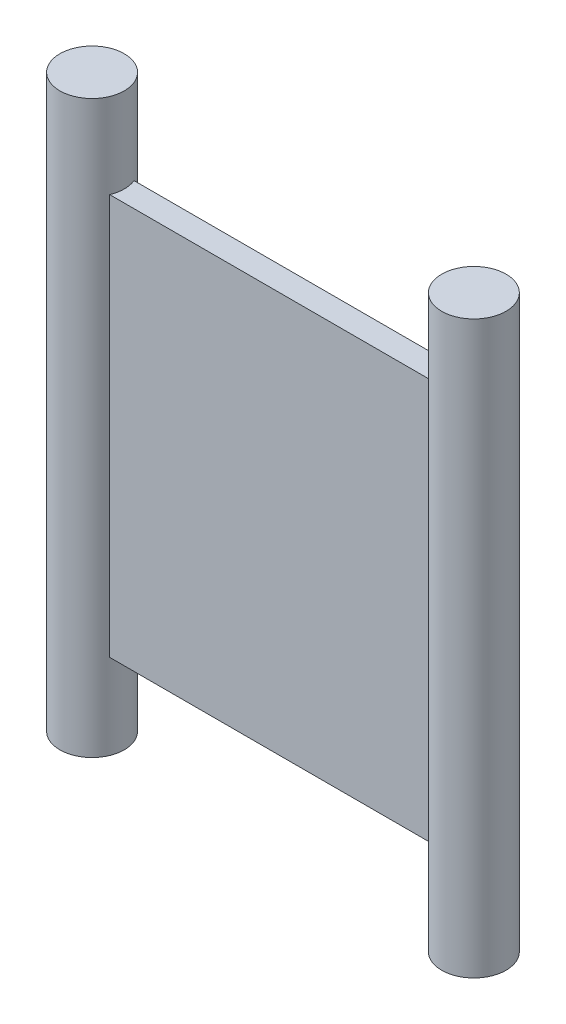
from build123d import *

# Parameters (mm, degrees)
SKETCH1_W           = 15.72
SKETCH1_H           = 1
BOSS_EXTRUDE1_DEPTH = 16.5
SKETCH2_R           = 1.325
BOSS_EXTRUDE2_DEPTH = 11.75


with BuildPart() as part:
    # Sketch1 → Boss-Extrude1 (new body)
    with BuildSketch(Plane(origin=(0, 0, 0), x_dir=(1, 0, 0), z_dir=(0, 1, 0))):
        Rectangle(SKETCH1_W, SKETCH1_H)
    extrude(amount=BOSS_EXTRUDE1_DEPTH)

    # Sketch2 → Boss-Extrude2 (add, symmetric)
    with BuildSketch(Plane(origin=(0, 8.25, 0), x_dir=(1, 0, 0), z_dir=(0, 1, 0))):
        with Locations(Location((-7.86, 0, 0), (0, 0, 270))):
            Circle(SKETCH2_R)
        with Locations(Location((7.86, 0, 0), (0, 0, 270))):
            Circle(SKETCH2_R)
    extrude(amount=BOSS_EXTRUDE2_DEPTH, both=True)


solid = part.part
